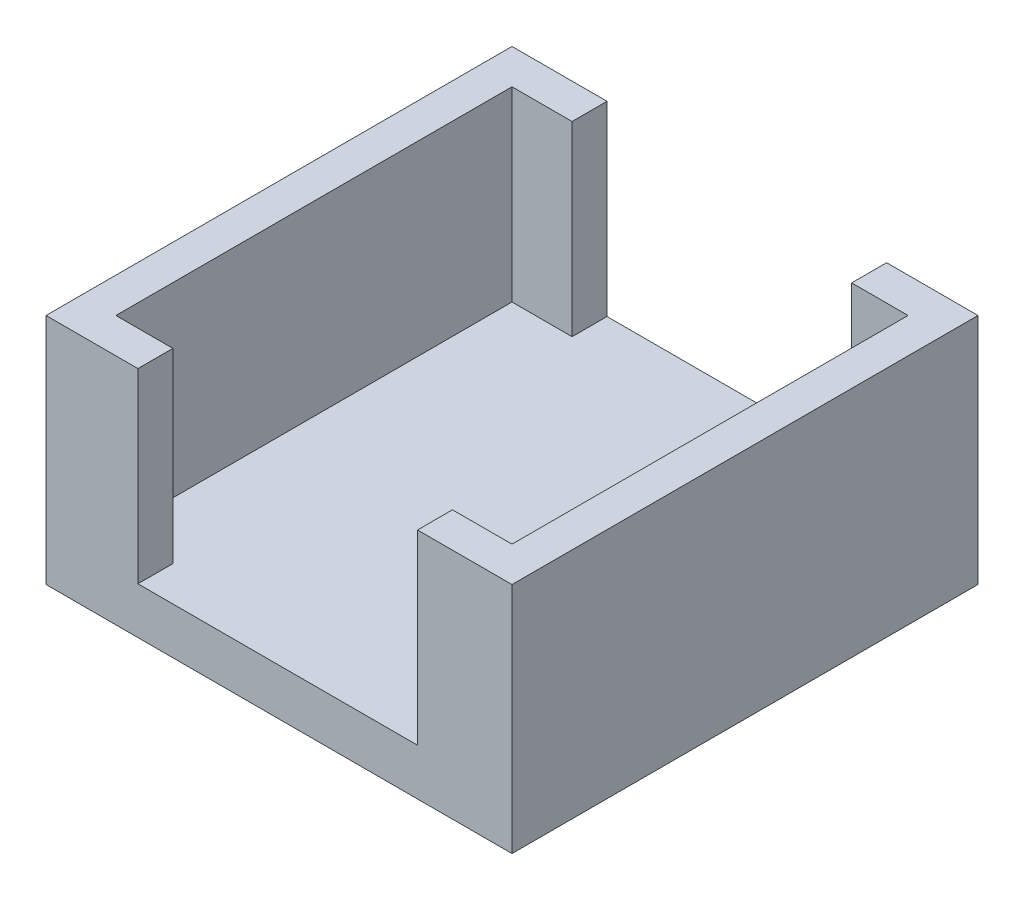
from build123d import *

# Parameters (mm, degrees)
SKETCH1_W           = 20
SKETCH1_H           = 20
SKETCH1_W_2         = 17
SKETCH1_H_2         = 17
BOSS_EXTRUDE2_DEPTH = 2
SKETCH1_4_W         = 20
SKETCH1_4_H         = 20
SKETCH1_4_W_2       = 17
SKETCH1_4_H_2       = 17
BOSS_EXTRUDE3_DEPTH = 10
SKETCH2_W           = 12
SKETCH2_H           = 1.5
CUT_EXTRUDE1_DEPTH  = 8


with BuildPart() as part:
    # Sketch1 → Boss-Extrude2 (new body)
    # profile 1 of 2: a face of its own
    with BuildSketch(Plane(origin=(0, 0, 0), x_dir=(1, 0, 0), z_dir=(0, 1, 0))):
        with Locations((8.5, 8.5)):
            Rectangle(SKETCH1_W, SKETCH1_H)
        with Locations((8.5, 8.5)):
            Rectangle(SKETCH1_W_2, SKETCH1_H_2, mode=Mode.SUBTRACT)
    # profile 2 of 2: a face of its own
    with BuildSketch(Plane(origin=(0, 0, 0), x_dir=(1, 0, 0), z_dir=(0, 1, 0))):
        with Locations((8.5, 8.5)):
            Rectangle(SKETCH1_W_2, SKETCH1_H_2)
    extrude(amount=BOSS_EXTRUDE2_DEPTH)

    # Sketch1<4> → Boss-Extrude3 (add)
    with BuildSketch(Plane(origin=(0, 0, 0), x_dir=(1, 0, 0), z_dir=(0, 1, 0))):
        with Locations((8.5, 8.5)):
            Rectangle(SKETCH1_4_W, SKETCH1_4_H)
        with Locations((8.5, 8.5)):
            Rectangle(SKETCH1_4_W_2, SKETCH1_4_H_2, mode=Mode.SUBTRACT)
    extrude(amount=BOSS_EXTRUDE3_DEPTH)

    # Sketch2 → Cut-Extrude1 (cut)
    with BuildSketch(Plane(origin=(0, 10, 0), x_dir=(1, 0, 0), z_dir=(0, 1, 0))):
        with Locations((8.577582313, 17.75)):
            Rectangle(SKETCH2_W, SKETCH2_H)
        with Locations((8.44538549, -0.75)):
            Rectangle(SKETCH2_W, SKETCH2_H)
    extrude(amount=-CUT_EXTRUDE1_DEPTH, mode=Mode.SUBTRACT)


solid = part.part
